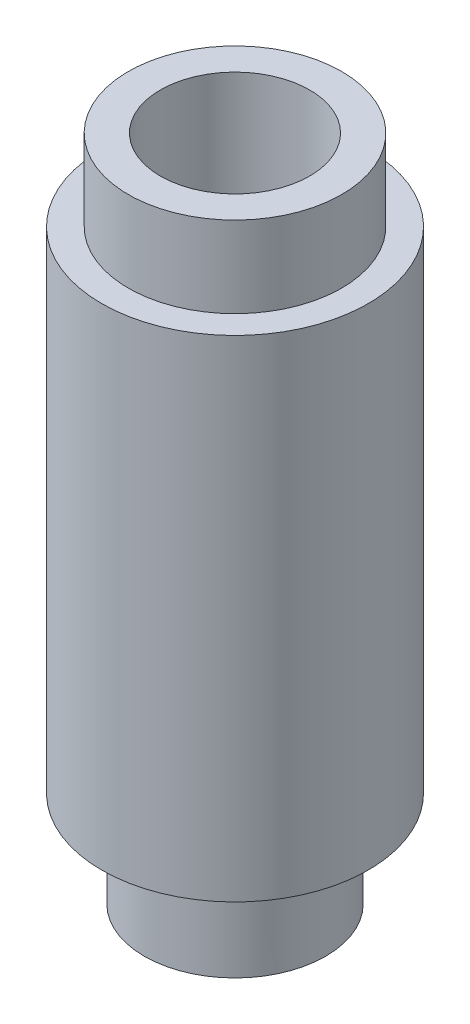
from build123d import *

# Parameters (mm, degrees)
SKETCH1_R           = 12.5
BOSS_EXTRUDE1_DEPTH = 46
SKETCH2_R           = 8.375
BOSS_EXTRUDE2_DEPTH = 4
SKETCH3_R           = 10
BOSS_EXTRUDE4_DEPTH = 7.6
SKETCH4_R           = 8.5
BOSS_EXTRUDE5_DEPTH = 9
SKETCH5_R           = 5
CUT_EXTRUDE1_DEPTH  = 66.048136022
SKETCH6_R           = 7
CUT_EXTRUDE2_DEPTH  = 66.048136022


with BuildPart() as part:
    # Sketch1 → Boss-Extrude1 (new body)
    with BuildSketch(Plane(origin=(0, 0, 0), x_dir=(1, 0, 0), z_dir=(0, 1, 0))):
        with Locations(Location((0, 0, 0), (0, 0, 270))):
            Circle(SKETCH1_R)
    extrude(amount=BOSS_EXTRUDE1_DEPTH)

    # Sketch2 → Boss-Extrude2 (add)
    with BuildSketch(Plane.XZ):
        with Locations(Location((0, 0, 0), (0, 0, 270))):
            Circle(SKETCH2_R)
    extrude(amount=BOSS_EXTRUDE2_DEPTH)

    # Sketch3 → Boss-Extrude4 (add)
    with BuildSketch(Plane(origin=(0, 46, 0), x_dir=(1, 0, 0), z_dir=(0, 1, 0))):
        with Locations(Location((0, 0, 0), (0, 0, 90))):
            Circle(SKETCH3_R)
    extrude(amount=BOSS_EXTRUDE4_DEPTH)

    # Sketch4 → Boss-Extrude5 (add)
    with BuildSketch(Plane.XZ):
        with Locations(Location((0, 0, 0), (0, 0, 90))):
            Circle(SKETCH4_R)
    extrude(amount=BOSS_EXTRUDE5_DEPTH)

    # Sketch5 → Cut-Extrude1 (cut, through all)
    with BuildSketch(Plane(origin=(0, 53.6, 0), x_dir=(1, 0, 0), z_dir=(0, 1, 0))):
        with Locations(Location((0, 0, 0), (0, 0, 270))):
            Circle(SKETCH5_R)
    extrude(amount=-CUT_EXTRUDE1_DEPTH, mode=Mode.SUBTRACT)

    # Sketch6 → Cut-Extrude2 (cut, through all)
    with BuildSketch(Plane(origin=(0, 53.6, 0), x_dir=(1, 0, 0), z_dir=(0, 1, 0))):
        with Locations(Location((0, 0, 0), (0, 0, 270))):
            Circle(SKETCH6_R)
    extrude(amount=-CUT_EXTRUDE2_DEPTH, mode=Mode.SUBTRACT)


solid = part.part
